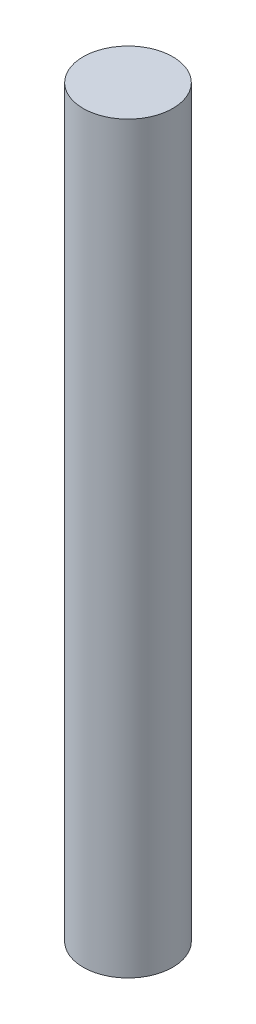
from build123d import *

# Parameters (mm, degrees)
SKETCH1_R           = 15
BOSS_EXTRUDE1_DEPTH = 249


with BuildPart() as part:
    # Sketch1 → Boss-Extrude1 (new body)
    with BuildSketch(Plane(origin=(0, 0, 0), x_dir=(1, 0, 0), z_dir=(0, 1, 0))):
        with Locations(Location((0, 0, 0), (0, 0, 270))):
            Circle(SKETCH1_R)
    extrude(amount=BOSS_EXTRUDE1_DEPTH)


solid = part.part
